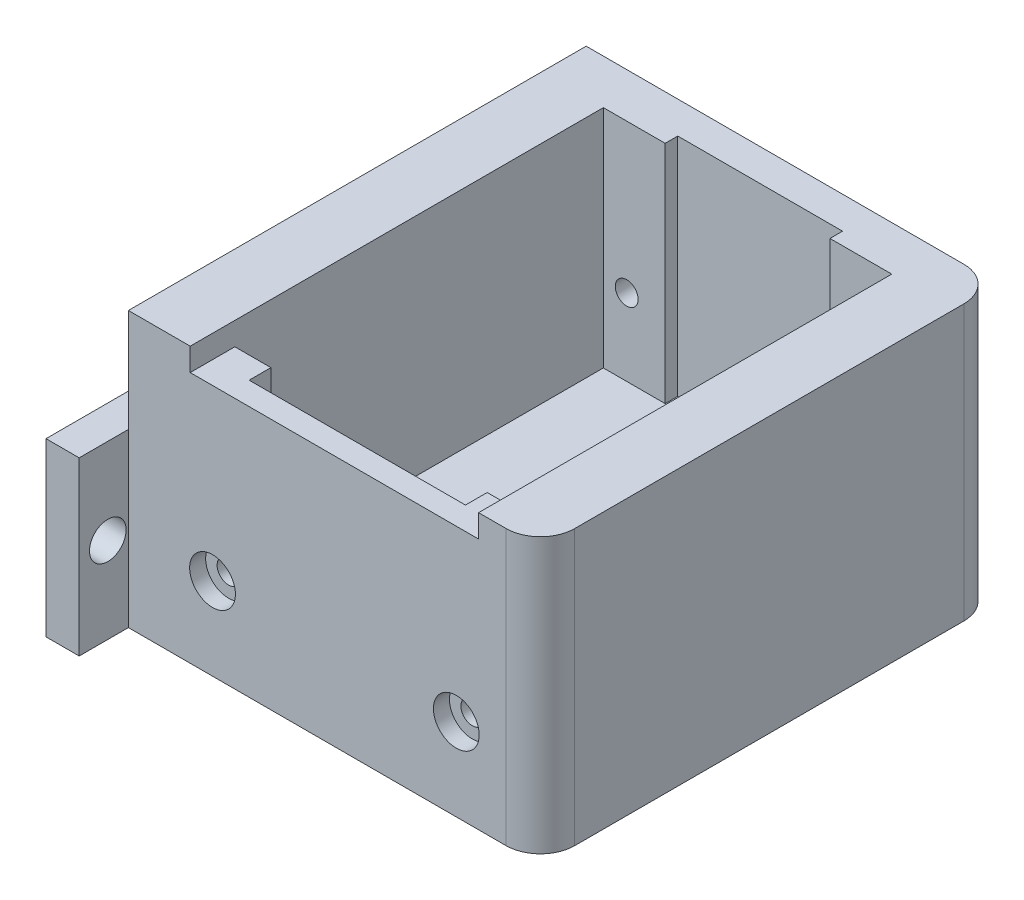
from build123d import *

# Parameters (mm, degrees)
SKETCH_3_W           = 36
SKETCH_3_H           = 50
EXTRUDE_1_DEPTH      = 24
SKETCH_4_W           = 24.8
SKETCH_4_H           = 31.8
CUT_EXTRUDE_1_DEPTH  = 19.7
SKETCH_5_W           = 14
SKETCH_5_H           = 2.2
CUT_EXTRUDE_3_DEPTH  = 19.7
SKETCH_6_W           = 18.5
SKETCH_6_H           = 3.8
CUT_EXTRUDE_4_DEPTH  = 14.7
SKETCH_7_W           = 24.8
SKETCH_7_H           = 24.280407208
CUT_EXTRUDE_5_DEPTH  = 2
SKETCH_8_R           = 2
CUT_EXTRUDE_6_DEPTH  = 6.4
SKETCH_9_R           = 1
CUT_EXTRUDE_7_DEPTH  = 6.4
SKETCH_10_R          = 2
CUT_EXTRUDE_8_DEPTH  = 7.4
SKETCH_11_R          = 1
CUT_EXTRUDE_9_DEPTH  = 7.4
SKETCH_14_W          = 47.693248889
SKETCH_14_H          = 41.94352182
CUT_EXTRUDE_12_DEPTH = 4
SKETCH_16_W          = 69.166934332
SKETCH_16_H          = 39.422219991
CUT_EXTRUDE_13_DEPTH = 5
CUT_EXTRUDE_17_DEPTH = 19.7
SKETCH_19_W          = 18.9
SKETCH_19_H          = 2.1
CUT_EXTRUDE_18_DEPTH = 12.7
SKETCH_21_W          = 12
SKETCH_21_H          = 15
EXTRUDE_2_DEPTH      = 2.9
SKETCH_24_W          = 40.92959711
SKETCH_24_H          = 30.072359406
CUT_EXTRUDE_20_DEPTH = 1
SKETCH_23_R          = 1.6
CUT_EXTRUDE_21_DEPTH = 10
SKETCH_25_W          = 25.2
SKETCH_25_H          = 37.099500986
CUT_EXTRUDE_22_DEPTH = 2
FILLET_1_R           = 3


with BuildPart() as part:
    # 草图3 → 凸台-拉伸1 (new body)
    with BuildSketch(Plane(origin=(0, 0, 0), x_dir=(1, 0, 0), z_dir=(0, 1, 0))):
        Rectangle(SKETCH_3_W, SKETCH_3_H)
    extrude(amount=EXTRUDE_1_DEPTH)

    # 草图4 → 切除-拉伸1 (cut)
    with BuildSketch(Plane(origin=(0, 24, 0), x_dir=(1, 0, 0), z_dir=(0, 1, 0))):
        Rectangle(SKETCH_4_W, SKETCH_4_H)
    extrude(amount=-CUT_EXTRUDE_1_DEPTH, mode=Mode.SUBTRACT)

    # 草图5 → 切除-拉伸3 (cut)
    with BuildSketch(Plane(origin=(0, 24, 0), x_dir=(1, 0, 0), z_dir=(0, 1, 0))):
        with Locations((0, 15.9)):
            Rectangle(SKETCH_5_W, SKETCH_5_H)
    extrude(amount=-CUT_EXTRUDE_3_DEPTH, mode=Mode.SUBTRACT)

    # 草图6 → 切除-拉伸4 (cut)
    with BuildSketch(Plane(origin=(0, 24, 0), x_dir=(1, 0, 0), z_dir=(0, 1, 0))):
        with Locations((0, -15.9)):
            Rectangle(SKETCH_6_W, SKETCH_6_H)
    extrude(amount=-CUT_EXTRUDE_4_DEPTH, mode=Mode.SUBTRACT)

    # 草图7 → 切除-拉伸5 (cut)
    with BuildSketch(Plane(origin=(0, 24, 0), x_dir=(1, 0, 0), z_dir=(0, 1, 0))):
        with Locations((0, -25)):
            Rectangle(SKETCH_7_W, SKETCH_7_H)
    extrude(amount=-CUT_EXTRUDE_5_DEPTH, mode=Mode.SUBTRACT)

    # 草图8 → 切除-拉伸6 (cut)
    with BuildSketch(Plane.XY.offset(25)):
        with Locations((10.65, 7.2)):
            Circle(SKETCH_8_R)
        with Locations((-10.65, 7.2)):
            Circle(SKETCH_8_R)
    extrude(amount=-CUT_EXTRUDE_6_DEPTH, mode=Mode.SUBTRACT)

    # 草图9 → 切除-拉伸7 (cut)
    with BuildSketch(Plane.XY.offset(18.6)):
        with Locations((10.65, 7.2)):
            Circle(SKETCH_9_R)
        with Locations((-10.65, 7.2)):
            Circle(SKETCH_9_R)
    extrude(amount=-CUT_EXTRUDE_7_DEPTH, mode=Mode.SUBTRACT)

    # 草图10 → 切除-拉伸8 (cut)
    with BuildSketch(Plane(origin=(0, 0, -25), x_dir=(-1, 0, 0), z_dir=(0, 0, -1))):
        with Locations((-10.565, 11)):
            Circle(SKETCH_10_R)
        with Locations((10.56, 11)):
            Circle(SKETCH_10_R)
    extrude(amount=-CUT_EXTRUDE_8_DEPTH, mode=Mode.SUBTRACT)

    # 草图11 → 切除-拉伸9 (cut)
    with BuildSketch(Plane(origin=(0, 0, -17.6), x_dir=(-1, 0, 0), z_dir=(0, 0, -1))):
        with Locations((10.56, 11)):
            Circle(SKETCH_11_R)
        with Locations((-10.565, 11)):
            Circle(SKETCH_11_R)
    extrude(amount=-CUT_EXTRUDE_9_DEPTH, mode=Mode.SUBTRACT)

    # 草图14 → 切除-拉伸12 (cut)
    with BuildSketch(Plane.XY.offset(25)):
        with Locations((-2.653720185, 12.393348568)):
            Rectangle(SKETCH_14_W, SKETCH_14_H)
    extrude(amount=-CUT_EXTRUDE_12_DEPTH, mode=Mode.SUBTRACT)

    # 草图16 → 切除-拉伸13 (cut)
    with BuildSketch(Plane(origin=(0, 0, -25), x_dir=(-1, 0, 0), z_dir=(0, 0, -1))):
        with Locations((0.858826259, 12.588310345)):
            Rectangle(SKETCH_16_W, SKETCH_16_H)
    extrude(amount=-CUT_EXTRUDE_13_DEPTH, mode=Mode.SUBTRACT)

    # 草图18 → 切除-拉伸17 (cut)
    with BuildSketch(Plane(origin=(0, 24, 0), x_dir=(1, 0, 0), z_dir=(0, 1, 0))):
        Polygon((-12.6, -16.1), (12.6, -16.1), (12.6, 16.1), (7.2, 16.1), (7.2, 17.2), (-7.2, 17.2), (-7.2, 16.1), (-12.6, 16.1), align=None)
    extrude(amount=-CUT_EXTRUDE_17_DEPTH, mode=Mode.SUBTRACT)

    # 草图19 → 切除-拉伸18 (cut)
    with BuildSketch(Plane(origin=(0, 22, 0), x_dir=(1, 0, 0), z_dir=(0, 1, 0))):
        with Locations((0, -16.95)):
            Rectangle(SKETCH_19_W, SKETCH_19_H)
    extrude(amount=-CUT_EXTRUDE_18_DEPTH, mode=Mode.SUBTRACT)

    # 草图21 → 凸台-拉伸2 (add)
    with BuildSketch(Plane.ZY.offset(18)):
        with Locations((-18.5, 7.5)):
            Rectangle(SKETCH_21_W, SKETCH_21_H)
        with Locations((18.3, 7.5)):
            Rectangle(SKETCH_21_W, SKETCH_21_H)
    extrude(amount=EXTRUDE_2_DEPTH)

    # 草图24 → 切除-拉伸20 (cut)
    with BuildSketch(Plane.XY.offset(21)):
        with Locations((2.464798555, 15.036179703)):
            Rectangle(SKETCH_24_W, SKETCH_24_H)
    extrude(amount=-CUT_EXTRUDE_20_DEPTH, mode=Mode.SUBTRACT)

    # 草图23 → 切除-拉伸21 (cut)
    with BuildSketch(Plane.ZY.offset(20.9)):
        with Locations((-22, 7.5)):
            Circle(SKETCH_23_R)
        with Locations((21.8, 7.5)):
            Circle(SKETCH_23_R)
    extrude(amount=-CUT_EXTRUDE_21_DEPTH, mode=Mode.SUBTRACT)

    # 草图25 → 切除-拉伸22 (cut)
    with BuildSketch(Plane(origin=(0, 24, 0), x_dir=(1, 0, 0), z_dir=(0, 1, 0))):
        with Locations((0, -2.449750493)):
            Rectangle(SKETCH_25_W, SKETCH_25_H)
    extrude(amount=-CUT_EXTRUDE_22_DEPTH, mode=Mode.SUBTRACT)

    # 圆角1
    fillet_1_edges = [part.edges().sort_by_distance(p)[0] for p in [
        (18, 12, -20),
        (18, 12, 20),
    ]]
    fillet(fillet_1_edges, radius=FILLET_1_R)


solid = part.part
